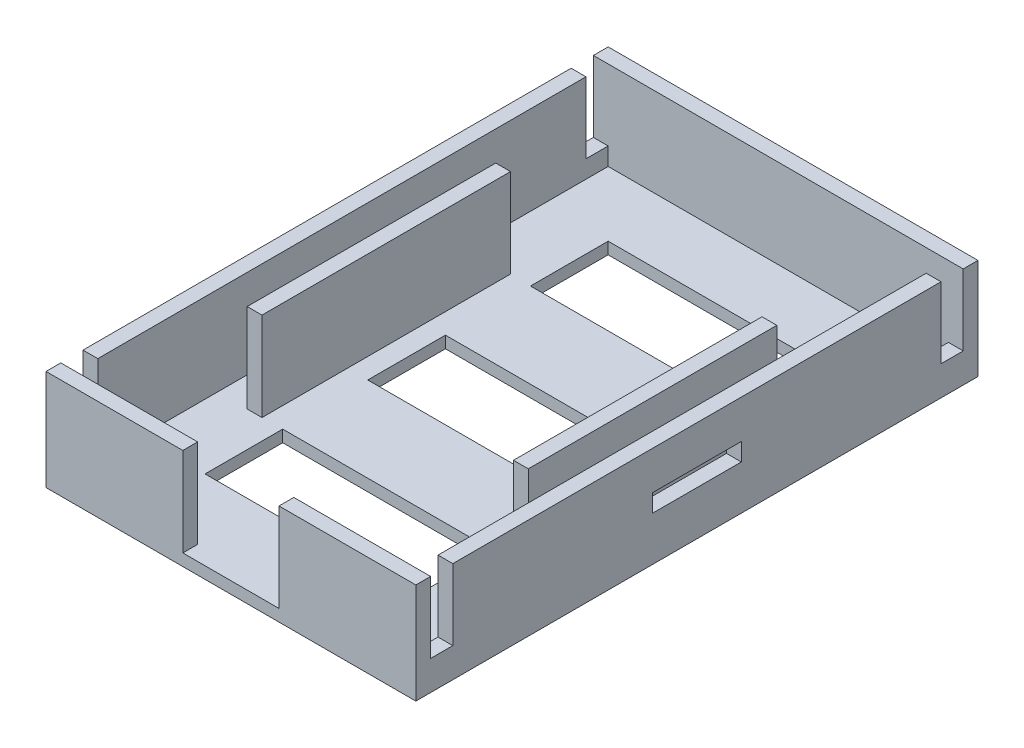
from build123d import *

# Parameters (mm, degrees)
SKETCH1_W                      = 25
SKETCH1_H                      = 38
BOSS_EXTRUDE1_DEPTH            = 6.8
SKETCH2_W                      = 23
SKETCH2_H                      = 36
CUT_EXTRUDE1_DEPTH             = 6
SKETCH2_3_W                    = 1
SKETCH2_3_H                    = 1.5
CUT_EXTRUDE2_DEPTH             = 4.8
CUT_EXTRUDE3_DEPTH             = 24.737944309
CUT_EXTRUDE3_DEPTH_BACK        = 24.737944309
SKETCH3_W                      = 6
SKETCH3_H                      = 1.2
CUT_EXTRUDE4_REACH             = 25.521
SKETCH4_W                      = 14.25
SKETCH4_H                      = 5.25
CUT_EXTRUDE4_DIRECTION_2_DEPTH = 24.521266973
SKETCH5_W                      = 1
SKETCH5_H                      = 16.8
BOSS_EXTRUDE2_DEPTH            = 6
SKETCH6_W                      = 6.5
SKETCH6_H                      = 1
CUT_EXTRUDE5_DEPTH             = 6


with BuildPart() as part:
    # Sketch1 → Boss-Extrude1 (new body)
    with BuildSketch(Plane(origin=(0, 0, 0), x_dir=(1, 0, 0), z_dir=(0, 1, 0))):
        Rectangle(SKETCH1_W, SKETCH1_H)
    extrude(amount=BOSS_EXTRUDE1_DEPTH)

    # Sketch2 → Cut-Extrude1 (cut)
    with BuildSketch(Plane(origin=(0, 6.8, 0), x_dir=(1, 0, 0), z_dir=(0, 1, 0))):
        Rectangle(SKETCH2_W, SKETCH2_H)
    extrude(amount=-CUT_EXTRUDE1_DEPTH, mode=Mode.SUBTRACT)

    # Sketch2<3> → Cut-Extrude2 (cut)
    with BuildSketch(Plane(origin=(0, 6.8, 0), x_dir=(1, 0, 0), z_dir=(0, 1, 0))):
        with Locations((-12, 17.25)):
            Rectangle(SKETCH2_3_W, SKETCH2_3_H)
        with Locations((12, 17.25)):
            Rectangle(SKETCH2_3_W, SKETCH2_3_H)
        with Locations((-12, -17.25)):
            Rectangle(SKETCH2_3_W, SKETCH2_3_H)
        with Locations((12, -17.25)):
            Rectangle(SKETCH2_3_W, SKETCH2_3_H)
    extrude(amount=-CUT_EXTRUDE2_DEPTH, mode=Mode.SUBTRACT)

    # Sketch3 → Cut-Extrude3 (cut, two sides: drawn at the far end of the back side and taken through both)
    with BuildSketch(Plane(origin=(0, 0, 0), x_dir=(0, 0, -1), z_dir=(1, 0, 0)).offset(-CUT_EXTRUDE3_DEPTH_BACK)):
        with Locations((0, 3.6)):
            Rectangle(SKETCH3_W, SKETCH3_H)
    extrude(amount=CUT_EXTRUDE3_DEPTH + CUT_EXTRUDE3_DEPTH_BACK, mode=Mode.SUBTRACT)

    # Sketch4 → Cut-Extrude4 (cut, up to next)
    with BuildSketch(Plane(origin=(0, 0.8, 0), x_dir=(1, 0, 0), z_dir=(0, 1, 0)), mode=Mode.PRIVATE) as cut_extrude4_sk1:
        with Locations((0, -11)):
            Rectangle(SKETCH4_W, SKETCH4_H)
    cut_extrude4_tool1 = extrude(cut_extrude4_sk1.sketch, amount=-CUT_EXTRUDE4_REACH, mode=Mode.PRIVATE) & part.part
    # Sketch4 → Cut-Extrude4 (cut, up to next)
    with BuildSketch(Plane(origin=(0, 0.8, 0), x_dir=(1, 0, 0), z_dir=(0, 1, 0)), mode=Mode.PRIVATE) as cut_extrude4_sk2:
        Rectangle(SKETCH4_W, SKETCH4_H)
    cut_extrude4_tool2 = extrude(cut_extrude4_sk2.sketch, amount=-CUT_EXTRUDE4_REACH, mode=Mode.PRIVATE) & part.part
    # Sketch4 → Cut-Extrude4 (cut, up to next)
    with BuildSketch(Plane(origin=(0, 0.8, 0), x_dir=(1, 0, 0), z_dir=(0, 1, 0)), mode=Mode.PRIVATE) as cut_extrude4_sk3:
        with Locations((0, 11)):
            Rectangle(SKETCH4_W, SKETCH4_H)
    cut_extrude4_tool3 = extrude(cut_extrude4_sk3.sketch, amount=-CUT_EXTRUDE4_REACH, mode=Mode.PRIVATE) & part.part
    add(cut_extrude4_tool1.solids().sort_by_distance((0, 0.8, 11))[0], mode=Mode.SUBTRACT)
    add(cut_extrude4_tool2.solids().sort_by_distance((0, 0.8, 0))[0], mode=Mode.SUBTRACT)
    add(cut_extrude4_tool3.solids().sort_by_distance((0, 0.8, -11))[0], mode=Mode.SUBTRACT)

    # Sketch4 → Cut-Extrude4 direction 2 (cut)
    with BuildSketch(Plane(origin=(0, 0.8, 0), x_dir=(1, 0, 0), z_dir=(0, 1, 0))):
        with Locations((0, -11)):
            Rectangle(SKETCH4_W, SKETCH4_H)
        Rectangle(SKETCH4_W, SKETCH4_H)
        with Locations((0, 11)):
            Rectangle(SKETCH4_W, SKETCH4_H)
    extrude(amount=CUT_EXTRUDE4_DIRECTION_2_DEPTH, mode=Mode.SUBTRACT)

    # Sketch5 → Boss-Extrude2 (add)
    with BuildSketch(Plane(origin=(0, 0.8, 0), x_dir=(1, 0, 0), z_dir=(0, 1, 0))):
        with Locations((-9, 0)):
            Rectangle(SKETCH5_W, SKETCH5_H)
        with Locations((9, 0)):
            Rectangle(SKETCH5_W, SKETCH5_H)
    extrude(amount=BOSS_EXTRUDE2_DEPTH)

    # Sketch6 → Cut-Extrude5 (cut)
    with BuildSketch(Plane(origin=(0, 6.8, 0), x_dir=(1, 0, 0), z_dir=(0, 1, 0))):
        with Locations((0, -18.5)):
            Rectangle(SKETCH6_W, SKETCH6_H)
    extrude(amount=-CUT_EXTRUDE5_DEPTH, mode=Mode.SUBTRACT)


solid = part.part
